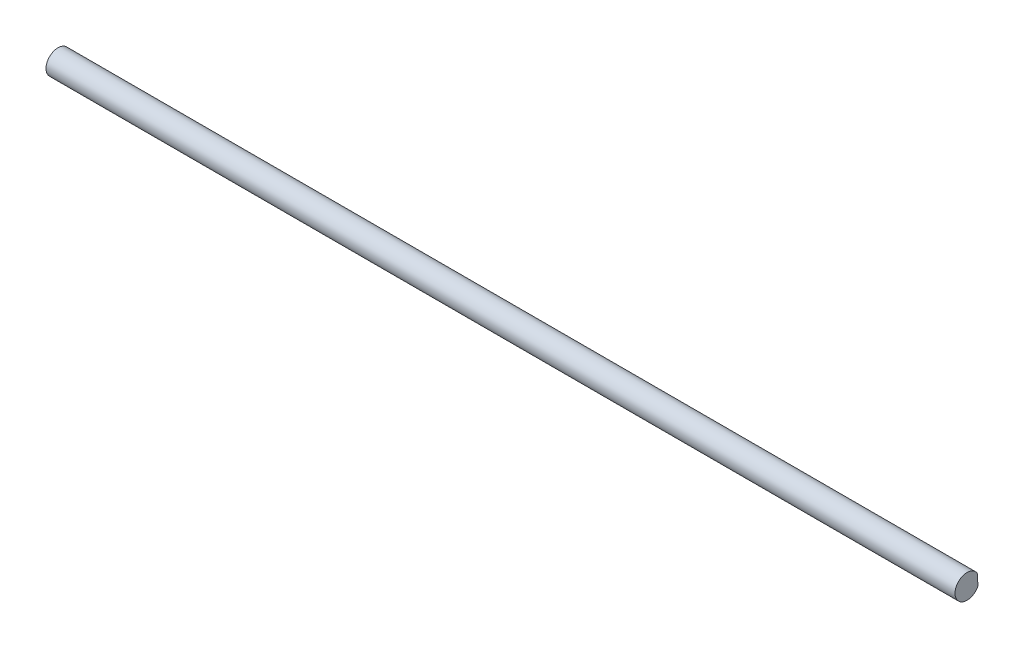
from build123d import *

# Parameters (mm, degrees)
BOSS_EXTRU_1_DEPTH = 240


with BuildPart() as part:
    # Esquisse1 → Boss.-Extru.1 (new body)
    with BuildSketch(Plane(origin=(0, 0, 0), x_dir=(0, 0, -1), z_dir=(1, 0, 0))):
        with BuildLine():
            Line((2.891496859, -1.31143849), (2.683155312, 1.697440006))
            ThreePointArc((2.683155312, 1.697440006), (-3.167416006, -0.219319043), (2.891496859, -1.31143849))
        make_face()
    extrude(amount=BOSS_EXTRU_1_DEPTH)


solid = part.part
